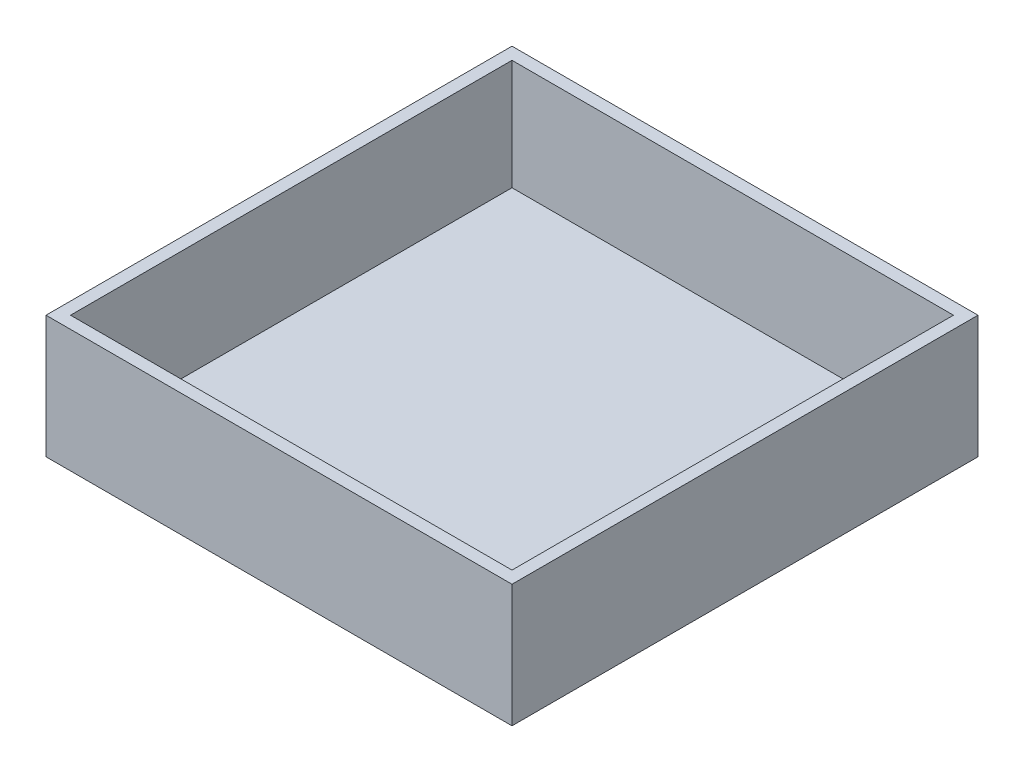
from build123d import *

# Parameters (mm, degrees)
SKETCH1_W           = 190
SKETCH1_H           = 190
SKETCH1_W_2         = 180
SKETCH1_H_2         = 180
BOSS_EXTRUDE1_DEPTH = 45
SKETCH2_W           = 190
SKETCH2_H           = 190
BOSS_EXTRUDE2_DEPTH = 5


with BuildPart() as part:
    # Sketch1 → Boss-Extrude1 (new body)
    with BuildSketch(Plane(origin=(0, 0, 0), x_dir=(1, 0, 0), z_dir=(0, 1, 0))):
        Rectangle(SKETCH1_W, SKETCH1_H)
        Rectangle(SKETCH1_W_2, SKETCH1_H_2, mode=Mode.SUBTRACT)
    extrude(amount=BOSS_EXTRUDE1_DEPTH)

    # Sketch2 → Boss-Extrude2 (add)
    with BuildSketch(Plane.XZ):
        Rectangle(SKETCH2_W, SKETCH2_H)
    extrude(amount=BOSS_EXTRUDE2_DEPTH)


solid = part.part
